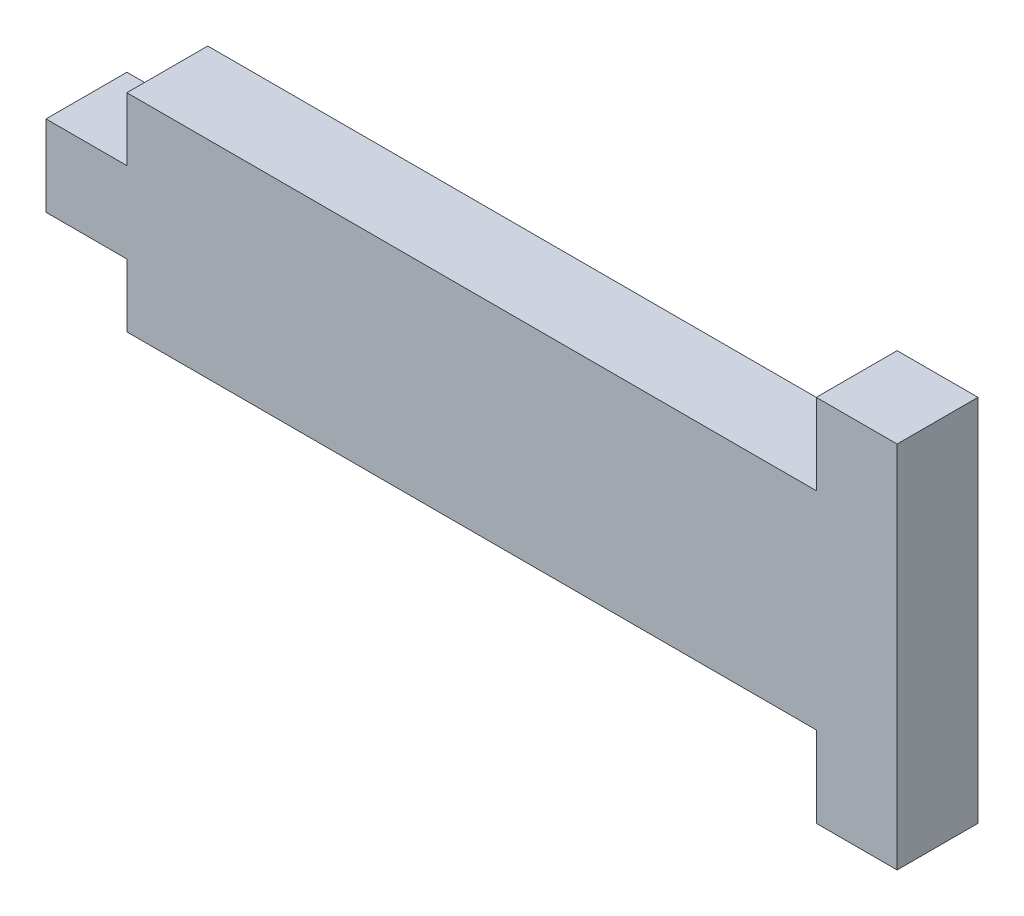
from build123d import *

# Parameters (mm, degrees)
BOSS_EXTRUDE1_DEPTH = 4.7625


with BuildPart() as part:
    # Sketch1 → Boss-Extrude1 (new body)
    with BuildSketch(Plane.XY):
        Polygon((25.0625, -4.7625), (25.0625, 16.9625), (20.3, 16.9625), (20.3, 12.2), (-20.3, 12.2), (-20.3, 8.48125), (-25.0625, 8.48125), (-25.0625, 3.71875), (-20.3, 3.71875), (-20.3, 0), (20.3, 0), (20.3, -4.7625), align=None)
    extrude(amount=BOSS_EXTRUDE1_DEPTH)


solid = part.part
